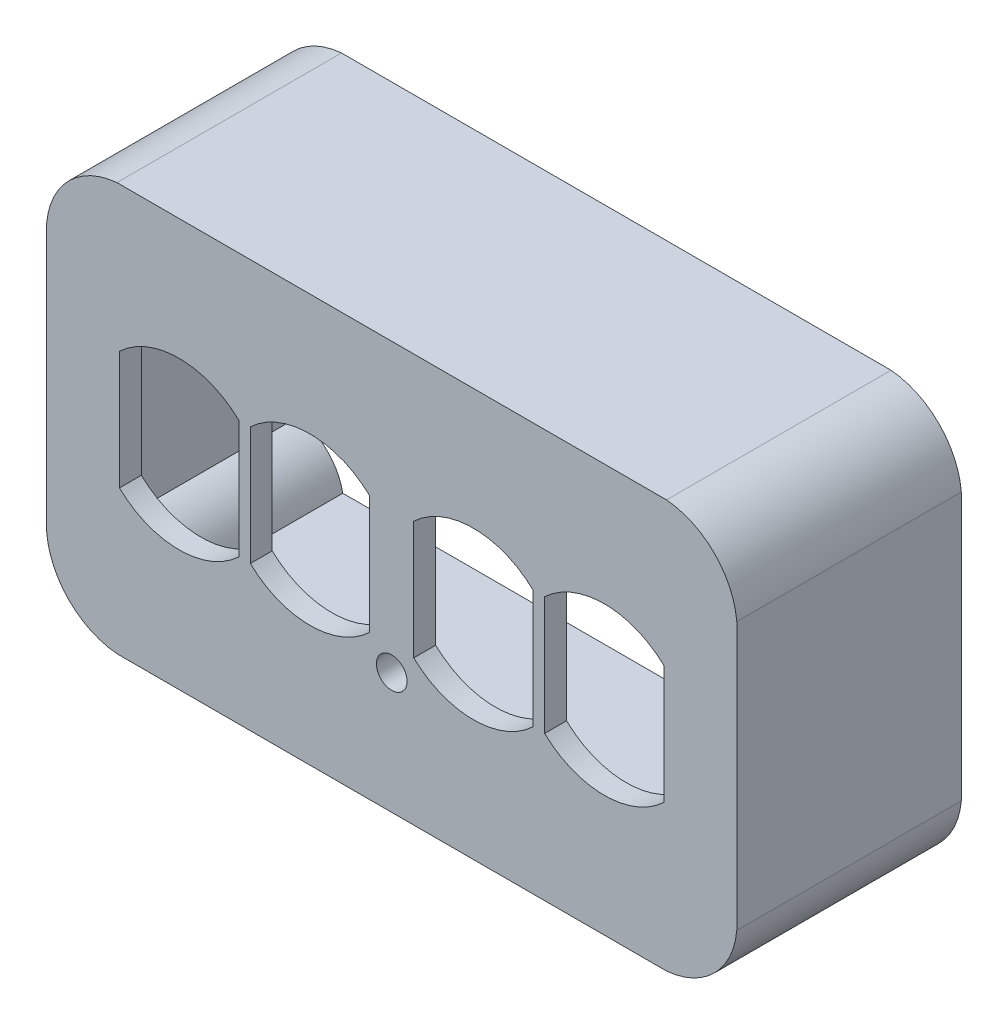
from build123d import *

# Parameters (mm, degrees)
SKETCH_1_W          = 106
SKETCH_1_H          = 54.5
EXTRUDE_1_DEPTH     = 4
SKETCH_2_R          = 2.8
CUT_EXTRUDE_1_DEPTH = 4
SKETCH_3_W          = 103.45800924
SKETCH_3_H          = 52.422924748
EXTRUDE_2_DEPTH     = 41
CUT_EXTRUDE_2_DEPTH = 36.7
EXTRUDE_START       = 36.7
EXTRUDE_3_DEPTH     = 36.7
SKETCH_7_R          = 1.6
CUT_EXTRUDE_3_DEPTH = 20


with BuildPart() as part:
    # Эскиз1 → Бобышка-Вытянуть1 (new body)
    with BuildSketch(Plane.XY):
        Rectangle(SKETCH_1_W, SKETCH_1_H)
    extrude(amount=EXTRUDE_1_DEPTH)

    # Эскиз2 → Вырез-Вытянуть1 (cut)
    with BuildSketch(Plane.XY.offset(4)):
        with Locations((0, -15.15)):
            Circle(SKETCH_2_R)
        with BuildLine():
            Line((-49.719324036, 10.805), (-49.719324036, -10.805))
            ThreePointArc((-49.719324036, -10.805), (-38.819324036, -15.15), (-27.919324036, -10.805))
            Line((-27.919324036, -10.805), (-27.919324036, 10.805))
            ThreePointArc((-27.919324036, 10.805), (-38.819324036, 15.15), (-49.719324036, 10.805))
        make_face()
        with BuildLine():
            Line((-25.819324036, 10.805), (-25.819324036, -10.805))
            ThreePointArc((-25.819324036, -10.805), (-14.919324036, -15.15), (-4.019324036, -10.805))
            Line((-4.019324036, -10.805), (-4.019324036, 10.805))
            ThreePointArc((-4.019324036, 10.805), (-14.919324036, 15.15), (-25.819324036, 10.805))
        make_face()
        with BuildLine():
            Line((4.019324036, 10.805), (4.019324036, -10.805))
            ThreePointArc((4.019324036, -10.805), (14.919324036, -15.15), (25.819324036, -10.805))
            Line((25.819324036, -10.805), (25.819324036, 10.805))
            ThreePointArc((25.819324036, 10.805), (14.919324036, 15.15), (4.019324036, 10.805))
        make_face()
        with BuildLine():
            Line((27.919324036, 10.805), (27.919324036, -10.805))
            ThreePointArc((27.919324036, -10.805), (38.819324036, -15.15), (49.719324036, -10.805))
            Line((49.719324036, -10.805), (49.719324036, 10.805))
            ThreePointArc((49.719324036, 10.805), (38.819324036, 15.15), (27.919324036, 10.805))
        make_face()
    extrude(amount=-CUT_EXTRUDE_1_DEPTH, mode=Mode.SUBTRACT)

    # Эскиз3 → Бобышка-Вытянуть2 (add)
    with BuildSketch(Plane.XY.offset(4)):
        with BuildLine():
            Line((63, -24.419804811), (63, 24.419804811))
            ThreePointArc((63, 24.419804811), (58.922335459, 33.172335459), (50.169804811, 37.25))
            Line((50.169804811, 37.25), (-50.169804811, 37.25))
            ThreePointArc((-50.169804811, 37.25), (-58.922335459, 33.172335459), (-63, 24.419804811))
            Line((-63, 24.419804811), (-63, -24.419804811))
            ThreePointArc((-63, -24.419804811), (-58.922335459, -33.172335459), (-50.169804811, -37.25))
            Line((-50.169804811, -37.25), (50.169804811, -37.25))
            ThreePointArc((50.169804811, -37.25), (58.922335459, -33.172335459), (63, -24.419804811))
        make_face()
        Rectangle(SKETCH_3_W, SKETCH_3_H, mode=Mode.SUBTRACT)
    extrude(amount=-EXTRUDE_2_DEPTH)

    # Эскиз5 → Вырез-Вытянуть2 (cut)
    with BuildSketch(Plane(origin=(0, 0, -37), x_dir=(-1, 0, 0), z_dir=(0, 0, -1))):
        with BuildLine():
            Line((-58, 24.179579232), (-58, -24.179579232))
            ThreePointArc((-58, -24.179579232), (-55.386801553, -29.636801553), (-49.929579232, -32.25))
            Line((-49.929579232, -32.25), (49.929579232, -32.25))
            ThreePointArc((49.929579232, -32.25), (55.386801553, -29.636801553), (58, -24.179579232))
            Line((58, -24.179579232), (58, 24.179579232))
            ThreePointArc((58, 24.179579232), (55.386801553, 29.636801553), (49.929579232, 32.25))
            Line((49.929579232, 32.25), (-49.929579232, 32.25))
            ThreePointArc((-49.929579232, 32.25), (-55.386801553, 29.636801553), (-58, 24.179579232))
        make_face()
    extrude(amount=-CUT_EXTRUDE_2_DEPTH, mode=Mode.SUBTRACT)

    # Эскиз6 → Бобышка-Вытянуть3 (add)
    with BuildSketch(Plane(origin=(0, 0, -0.3), x_dir=(-1, 0, 0), z_dir=(0, 0, -1)).offset(EXTRUDE_START)):
        with BuildLine():
            ThreePointArc((-49.929579232, 32.25), (-52.743515709, 26.993515709), (-58, 24.179579232))
            ThreePointArc((-58, 24.179579232), (-55.386801553, 29.636801553), (-49.929579232, 32.25))
        make_face()
        with BuildLine():
            ThreePointArc((49.929579232, 32.25), (55.386801553, 29.636801553), (58, 24.179579232))
            ThreePointArc((58, 24.179579232), (52.743515709, 26.993515709), (49.929579232, 32.25))
        make_face()
        with BuildLine():
            ThreePointArc((49.929579232, -32.25), (52.743515709, -26.993515709), (58, -24.179579232))
            ThreePointArc((58, -24.179579232), (55.386801553, -29.636801553), (49.929579232, -32.25))
        make_face()
        with BuildLine():
            ThreePointArc((-49.929579232, -32.25), (-55.386801553, -29.636801553), (-58, -24.179579232))
            ThreePointArc((-58, -24.179579232), (-52.743515709, -26.993515709), (-49.929579232, -32.25))
        make_face()
    extrude(amount=-EXTRUDE_3_DEPTH)

    # Эскиз7 → Вырез-Вытянуть3 (cut)
    with BuildSketch(Plane(origin=(0, 0, -37), x_dir=(-1, 0, 0), z_dir=(0, 0, -1))):
        with Locations((-55.91502671, 29.970875188)):
            Circle(SKETCH_7_R)
        with Locations(Location((55.91502671, 29.970875188, 0), (0, 0, 180))):
            Circle(SKETCH_7_R)
        with Locations((55.91502671, -29.970875188)):
            Circle(SKETCH_7_R)
        with Locations(Location((-55.91502671, -29.970875188, 0), (0, 0, 180))):
            Circle(SKETCH_7_R)
    extrude(amount=-CUT_EXTRUDE_3_DEPTH, mode=Mode.SUBTRACT)


solid = part.part
